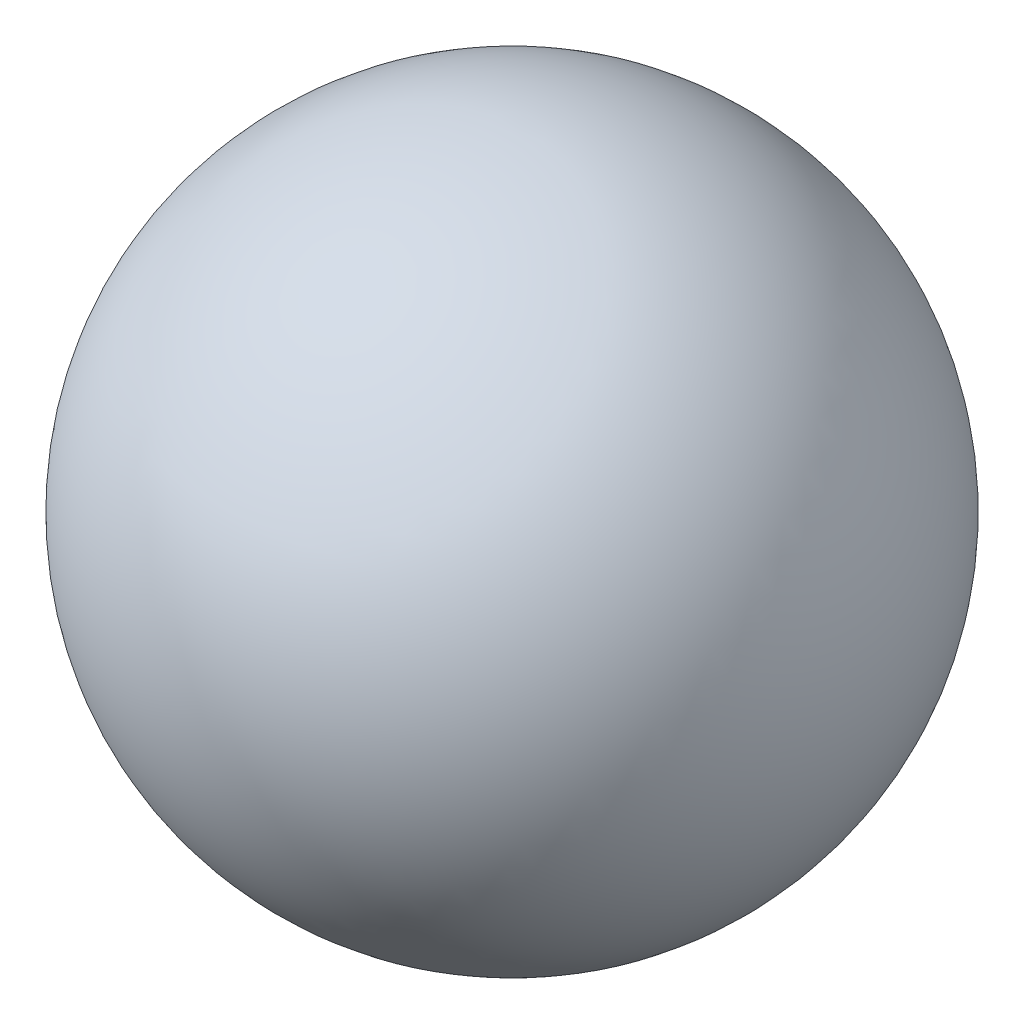
from build123d import *


with BuildPart() as part:
    # Sketch1 → Revolve1 (revolve)
    with BuildSketch(Plane.XY):
        with BuildLine():
            Line((0, 25), (0, -25))
            ThreePointArc((0, -25), (25, 0), (0, 25))
        make_face()
    revolve(axis=Axis((0, 40.813953488, 0), (0, -1, 0)))


solid = part.part
